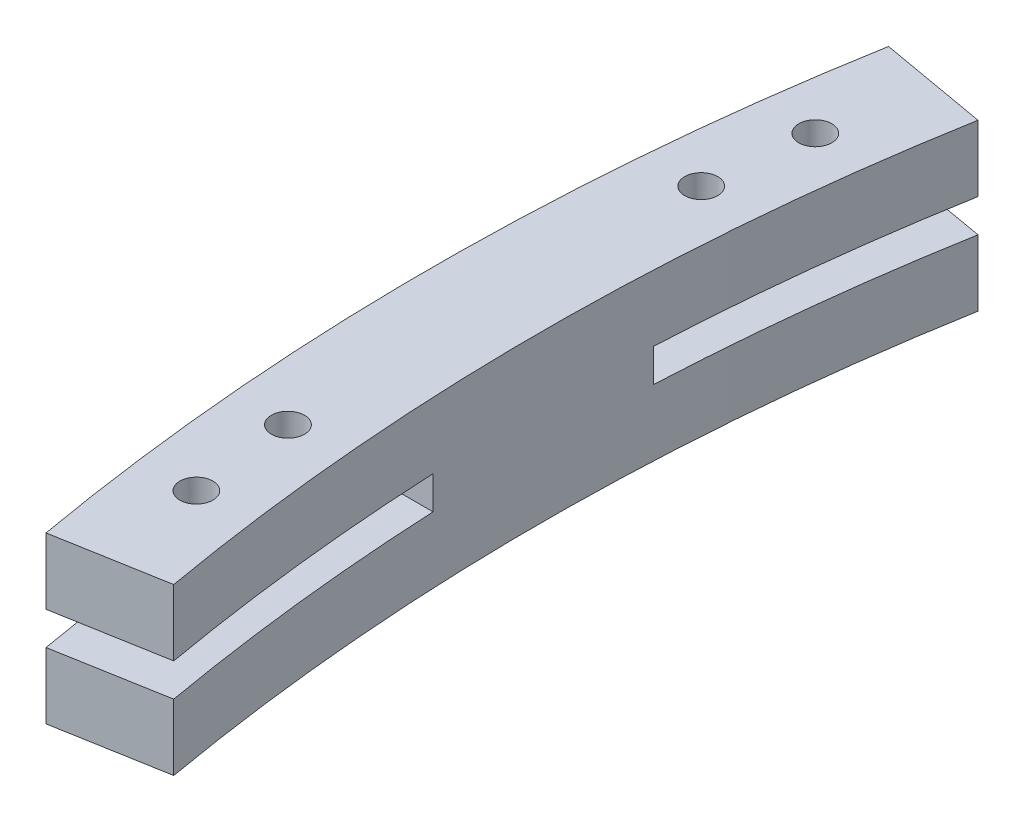
from build123d import *

# Parameters (mm, degrees)
BASE2_DEPTH            = 7.5
MOUNT2_START           = -1.5
MOUNT2_DEPTH           = 3
MOUNT_HOLE2_DEPTH      = 224.418192135
MOUNT_HOLE2_DEPTH_BACK = 224.418192135
SKETCH16_R             = 1.5
SKETCH18_W             = 2.5
SKETCH18_H             = 3
SKETCH19_R             = 1.5
CUT_EXTRUDE10_DEPTH    = 40.784051683


with BuildPart() as part:
    # Sketch13 → base2 (new, symmetric)
    with BuildSketch(Plane(origin=(0, 0, 0), x_dir=(1, 0, 0), z_dir=(0, 1, 0))):
        with BuildLine():
            ThreePointArc((-209.761769634, 10), (-208.70564487, 23.279901188), (-206.809628133, 36.46611731))
            Line((-206.809628133, 36.46611731), (-216.657705663, 38.202599087))
            ThreePointArc((-216.657705663, 38.202599087), (-218.670303662, 24.151569236), (-219.772609758, 10))
            Line((-219.772609758, 10), (-209.761769634, 10))
        make_face()
        with BuildLine():
            ThreePointArc((-209.761769634, -10), (-210, 0), (-209.761769634, 10))
            Line((-209.761769634, 10), (-219.772609758, 10))
            ThreePointArc((-219.772609758, 10), (-220, 0), (-219.772609758, -10))
            Line((-219.772609758, -10), (-209.761769634, -10))
        make_face()
        with BuildLine():
            Line((-216.657705663, -38.202599087), (-206.809628133, -36.46611731))
            ThreePointArc((-206.809628133, -36.46611731), (-208.70564487, -23.279901188), (-209.761769634, -10))
            Line((-209.761769634, -10), (-219.772609758, -10))
            ThreePointArc((-219.772609758, -10), (-218.670303662, -24.151569236), (-216.657705663, -38.202599087))
        make_face()
    extrude(amount=BASE2_DEPTH, both=True)

    # Sketch14 → mount2 (cut)
    with BuildSketch(Plane(origin=(0, 0, 0), x_dir=(1, 0, 0), z_dir=(0, 1, 0)).offset(MOUNT2_START)):
        with BuildLine():
            Line((-209.761769634, -10), (-219.772609758, -10))
            ThreePointArc((-219.772609758, -10), (-218.670303662, -24.151569236), (-216.657705663, -38.202599087))
            Line((-216.657705663, -38.202599087), (-206.809628133, -36.46611731))
            ThreePointArc((-206.809628133, -36.46611731), (-208.70564487, -23.279901188), (-209.761769634, -10))
        make_face()
        with BuildLine():
            Line((-209.761769634, 10), (-219.772609758, 10))
            ThreePointArc((-219.772609758, 10), (-218.670303662, 24.151569236), (-216.657705663, 38.202599087))
            Line((-216.657705663, 38.202599087), (-206.809628133, 36.46611731))
            ThreePointArc((-206.809628133, 36.46611731), (-208.70564487, 23.279901188), (-209.761769634, 10))
        make_face()
    extrude(amount=MOUNT2_DEPTH, mode=Mode.SUBTRACT)

    # Sketch16 → mount hole2 (cut, two sides: drawn at the far end of the back side and taken through both)
    with BuildSketch(Plane(origin=(0, 0, 0), x_dir=(1, 0, 0), z_dir=(0, 1, 0)).offset(-MOUNT_HOLE2_DEPTH_BACK)):
        with Locations(Location((-213.160645195, 28.063131327, 0), (0, 0, 270))):
            Circle(SKETCH16_R)
        with Locations(Location((-214.18186009, 18.738484691, 0), (0, 0, 270))):
            Circle(SKETCH16_R)
        with Locations(Location((-214.18186009, -18.738484691, 0), (0, 0, 270))):
            Circle(SKETCH16_R)
        with Locations(Location((-213.160645195, -28.063131327, 0), (0, 0, 270))):
            Circle(SKETCH16_R)
    extrude(amount=MOUNT_HOLE2_DEPTH + MOUNT_HOLE2_DEPTH_BACK, mode=Mode.SUBTRACT)

    # Sketch18 → bearing (revolve, cut)
    with BuildSketch(Plane(origin=(0, 0, 0), x_dir=(1, 0, 0), z_dir=(0, 1, 0)), mode=Mode.PRIVATE) as bearing_sk:
        with Locations((-215, 1.5)):
            Rectangle(SKETCH18_W, SKETCH18_H)
    revolve(bearing_sk.sketch.rotate(Axis((-215, 0, 0), (1, 0, 0)), 180), axis=Axis((-215, 0, 0), (1, 0, 0)), mode=Mode.SUBTRACT)

    # Sketch19 → Cut-Extrude10 (cut, through all)
    with BuildSketch(Plane(origin=(-215, 0, 0), x_dir=(0, 0, -1), z_dir=(1, 0, 0))):
        Circle(SKETCH19_R)
    extrude(amount=-CUT_EXTRUDE10_DEPTH, mode=Mode.SUBTRACT)


solid = part.part
